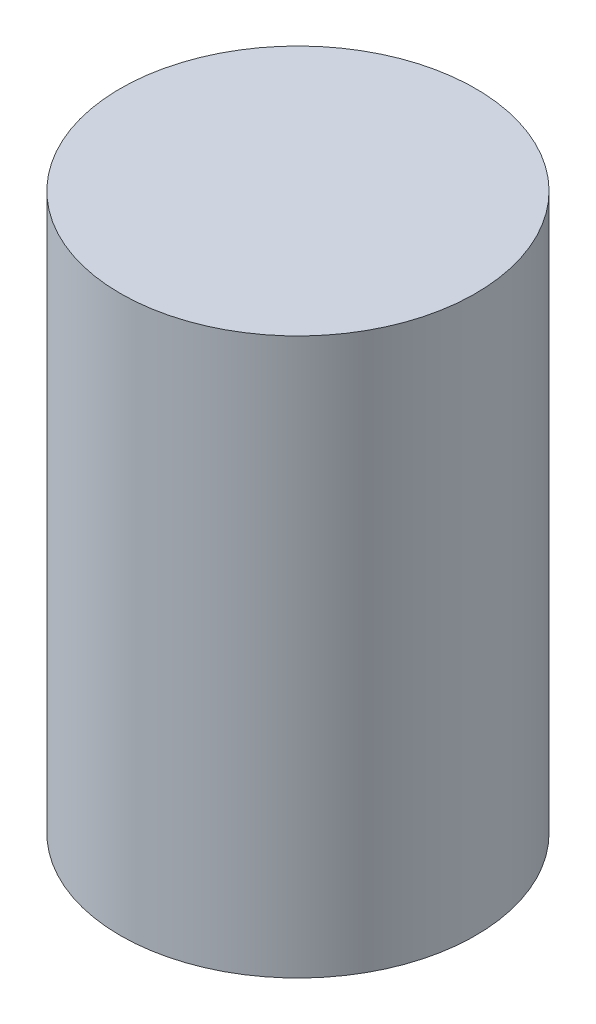
from build123d import *

# Parameters (mm, degrees)
SKETCH1_R           = 9.9
BOSS_EXTRUDE1_DEPTH = 31


with BuildPart() as part:
    # Sketch1 → Boss-Extrude1 (new body)
    with BuildSketch(Plane(origin=(0, 0, 0), x_dir=(1, 0, 0), z_dir=(0, 1, 0))):
        with Locations(Location((0, 0, 0), (0, 0, 270))):
            Circle(SKETCH1_R)
    extrude(amount=BOSS_EXTRUDE1_DEPTH)


solid = part.part
